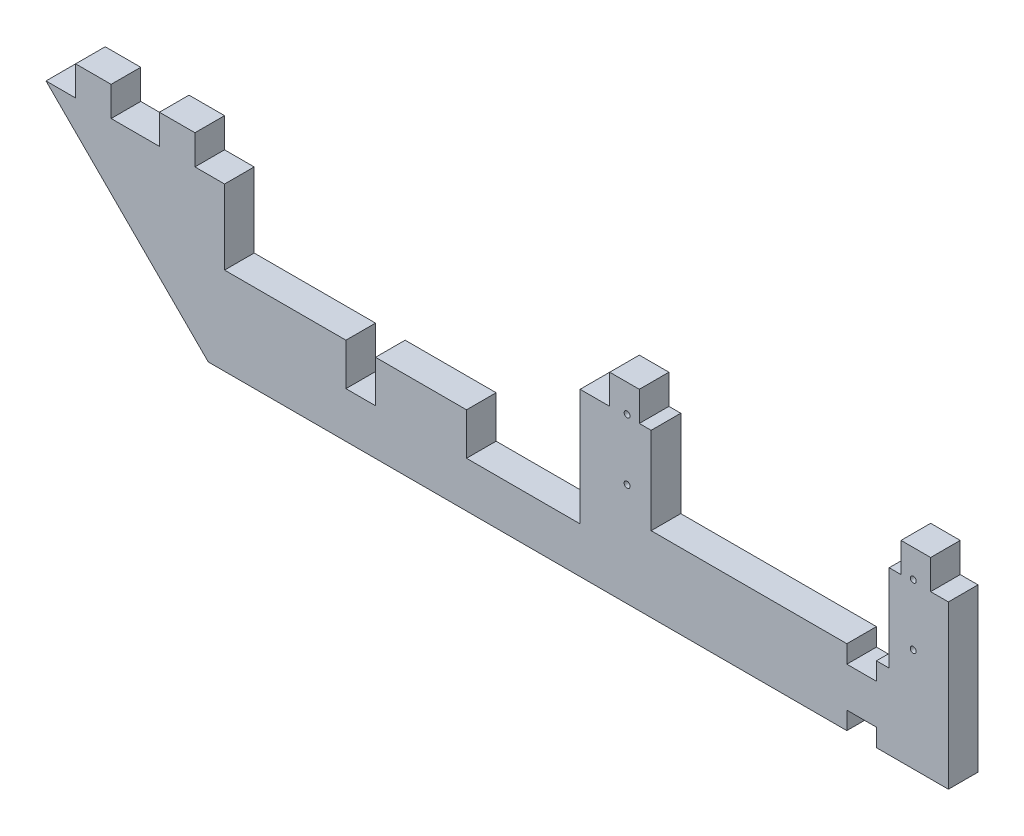
from build123d import *

# Parameters (mm, degrees)
BOSS_EXTRU_1_DEPTH = 5
ESQUISSE2_W        = 5
ESQUISSE2_H        = 3
ESQUISSE2_H_2      = 7.0925
ESQUISSE2_W_2      = 3
ESQUISSE2_H_3      = 5
ESQUISSE2_W_3      = 2
ESQUISSE2_W_4      = 8.154681838
ESQUISSE2_W_5      = 10
CR_NEAUX_DEPTH     = 5
ESQUISSE3_R        = 0.5
PER_AGES_DEPTH     = 5


with BuildPart() as part:
    # Esquisse1 → Boss.-Extru.1 (new body)
    with BuildSketch(Plane.XY):
        Polygon((-40.2, 0), (-40.2, -19.685), (0, -19.685), (0, 0), (10, 0), (10, -32.401636706), (-115, -32.401636706), (-147.401636706, 0), (-112.246954868, 0), (-112.246954868, -17.5925), (-71.384202009, -17.5925), (-71.384202009, -24.685), (-52.2, -24.685), (-52.2, 0), align=None)
    extrude(amount=BOSS_EXTRU_1_DEPTH)

    # Esquisse2 → Créneaux - (cut)
    with BuildSketch(Plane(origin=(0, 0, 0), x_dir=(-1, 0, 0), z_dir=(0, 0, -1))):
        with Locations((4.65, -21.185)):
            Rectangle(ESQUISSE2_W, ESQUISSE2_H)
        with Locations((89.250434868, -21.13875)):
            Rectangle(ESQUISSE2_W, ESQUISSE2_H_2)
        with Locations((4.65, -30.901636706)):
            Rectangle(ESQUISSE2_W, ESQUISSE2_H)
        with Locations((-8.5, -2.5)):
            Rectangle(ESQUISSE2_W_2, ESQUISSE2_H_3)
        with Locations((-1, -2.5)):
            Rectangle(ESQUISSE2_W_3, ESQUISSE2_H_3)
        with Locations((41.2, -2.5)):
            Rectangle(ESQUISSE2_W_3, ESQUISSE2_H_3)
        with Locations((49.7, -2.5)):
            Rectangle(ESQUISSE2_W, ESQUISSE2_H_3)
        with Locations((114.746954868, -2.5)):
            Rectangle(ESQUISSE2_W, ESQUISSE2_H_3)
        with Locations((127.324295787, -2.5)):
            Rectangle(ESQUISSE2_W_4, ESQUISSE2_H_3)
        with Locations((142.401636706, -2.5)):
            Rectangle(ESQUISSE2_W_5, ESQUISSE2_H_3)
    extrude(amount=-CR_NEAUX_DEPTH, mode=Mode.SUBTRACT)

    # Esquisse3 → Perçages (cut)
    with BuildSketch(Plane(origin=(0, 0, 0), x_dir=(-1, 0, 0), z_dir=(0, 0, -1))):
        with Locations((-4.064, -14.986)):
            Circle(ESQUISSE3_R)
        with Locations((-4.064, -4.699)):
            Circle(ESQUISSE3_R)
        with Locations((44.264, -14.986)):
            Circle(ESQUISSE3_R)
        with Locations((44.264, -4.699)):
            Circle(ESQUISSE3_R)
    extrude(amount=-PER_AGES_DEPTH, mode=Mode.SUBTRACT)


solid = part.part
